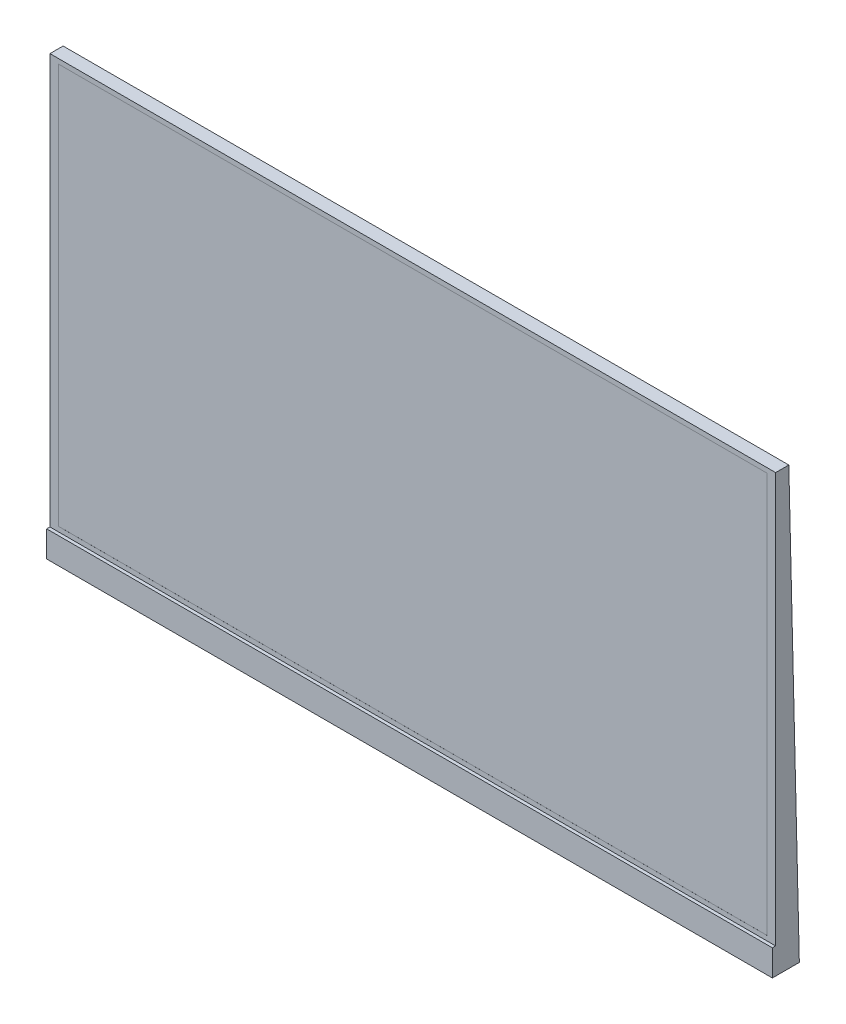
from build123d import *

# Parameters (mm, degrees)
SKETCH1_W           = 538.9562500000001
SKETCH1_H           = 323.84999999999997
BOSS_EXTRUDE1_DEPTH = 9.525
BOSS_EXTRUDE2_DEPTH = 538.95625
BOSS_EXTRUDE3_DEPTH = 538.95625
CUT_EXTRUDE1_DEPTH  = 317.16786663403565
FILLET1_R           = 19.05
SKETCH6_W           = 526.3492063472065
SKETCH6_H           = 297.32296140336337
CUT_EXTRUDE2_DEPTH  = 0.0254


with BuildPart() as part:
    # Sketch1 → Boss-Extrude1 (new body)
    with BuildSketch(Plane.XY):
        Rectangle(SKETCH1_W, SKETCH1_H)
    extrude(amount=BOSS_EXTRUDE1_DEPTH)

    # Sketch3 → Boss-Extrude2 (add)
    with BuildSketch(Plane(origin=(269.47812500000003, 0, 0), x_dir=(0, 0, -1), z_dir=(1, 0, 0))):
        Polygon((-9.525, 161.92499999999998), (0.253999999999999, 161.92499999999998), (8.062497413649258, -161.92499999999998), (0, -161.92499999999998), (-9.525, -161.92499999999998), (-11.952702586350743, -161.92499999999998), (-11.95270258635074, -142.5194), (-9.525, -142.5194), align=None)
    extrude(amount=-BOSS_EXTRUDE2_DEPTH)

    # Sketch4 → Boss-Extrude3 (add)
    with BuildSketch(Plane(origin=(269.47812500000003, 0, 0), x_dir=(0, 0, -1), z_dir=(1, 0, 0))):
        Polygon((37.193592332721494, 78.37169999999999), (36.576258201765725, -80.3770996759999), (6.157552828059534, -82.9192359761992), (2.191447852529644, 81.57119390858017), align=None)
    extrude(amount=-BOSS_EXTRUDE3_DEPTH)

    # Sketch5 → Cut-Extrude1 (cut, through all)
    with BuildSketch(Plane(origin=(0, 0.10020320699075866, -4.1558326608693195), x_dir=(-1, 0, 0), z_dir=(0, 0.024104457676112176, -0.9997094453490677))):
        Polygon((-139.684125, -83.04356787806702), (-139.68412500000005, 81.4946693567972), (-269.47812500000003, 81.49466935679719), (-269.47812500000003, -83.04356787806695), align=None)
        Polygon((269.47812500000003, 81.4946693567972), (139.71587499999993, 81.49466935679719), (139.71587499999995, -83.04356787806701), (269.47812500000003, -83.04356787806702), align=None)
    extrude(amount=CUT_EXTRUDE1_DEPTH, mode=Mode.SUBTRACT)

    # Fillet1
    fillet1_edges = [part.edges().sort_by_distance(p)[0] for p in [
        (-0.01587499999999409, -82.9192359761992, -6.157552828059534),
        (-0.01587499999993724, 81.57119390858017, -2.191447852529644),
        (139.68412500000002, -0.6740210338095626, -4.17450034029459),
        (-139.71587499999993, -0.6740210338095626, -4.17450034029459),
    ]]
    fillet(fillet1_edges, radius=FILLET1_R)

    # Sketch6 → Cut-Extrude2 (cut)
    with BuildSketch(Plane.XY.offset(9.525)):
        with Locations((2.842e-14, 9.70280000000001)):
            Rectangle(SKETCH6_W, SKETCH6_H)
    extrude(amount=-CUT_EXTRUDE2_DEPTH, mode=Mode.SUBTRACT)


solid = part.part
